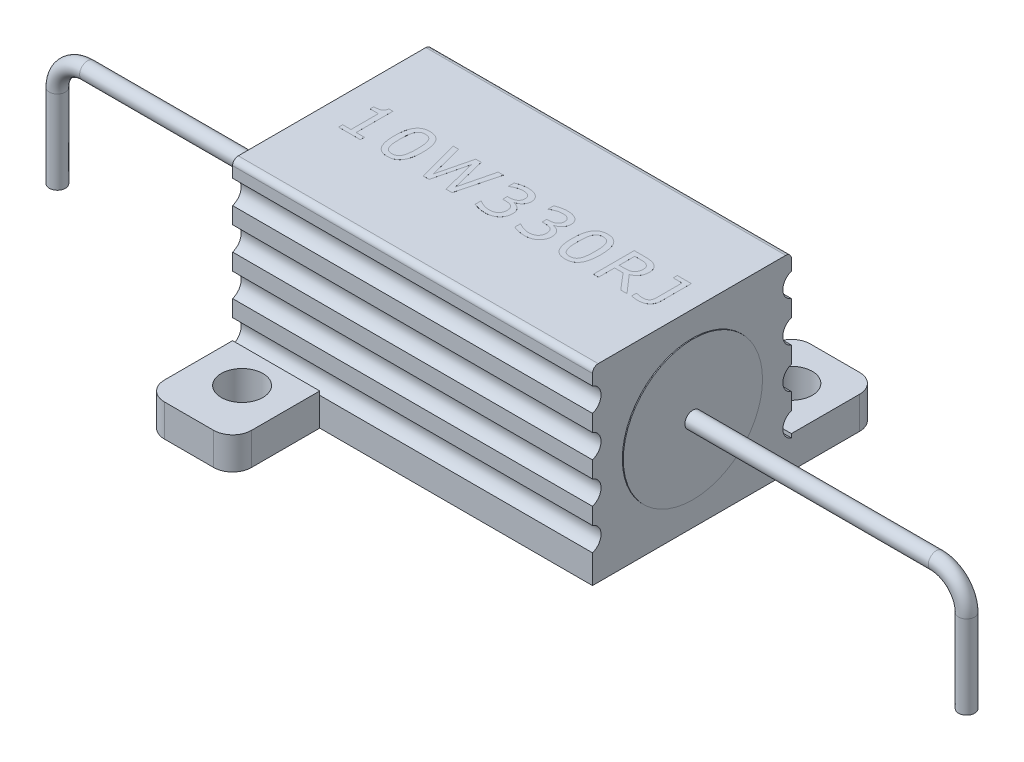
from build123d import *

# Parameters (mm, degrees)
BOSS_EXTRUDE1_DEPTH = 9.5
SKETCH2_R           = 1.1
BOSS_EXTRUDE2_DEPTH = 1.7
SKETCH3_R           = 3.675
BOSS_EXTRUDE3_DEPTH = 9.55
BOSS_EXTRUDE6_DEPTH = 0.001
SWEEP1_PROFILE_R    = 0.425


with BuildPart() as part:
    # Sketch1 → Boss-Extrude1 (new, symmetric)
    with BuildSketch(Plane(origin=(0, 0, 0), x_dir=(0, 0, -1), z_dir=(1, 0, 0))):
        with BuildLine():
            Line((-4.95, 5), (4.95, 5))
            ThreePointArc((4.95, 5), (5.162132034, 4.912132034), (5.25, 4.7))
            Line((5.25, 4.7), (5.25, 4.125))
            ThreePointArc((5.25, 4.125), (4.8, 3.5), (5.25, 2.875))
            Line((5.25, 2.875), (5.25, 2))
            ThreePointArc((5.25, 2), (4.8, 1.375), (5.25, 0.75))
            Line((5.25, 0.75), (5.25, -0.125))
            ThreePointArc((5.25, -0.125), (4.8, -0.75), (5.25, -1.375))
            Line((5.25, -1.375), (5.25, -2.25))
            ThreePointArc((5.25, -2.25), (4.8, -2.875), (5.25, -3.5))
            Line((5.25, -3.5), (5.25, -5))
            Line((5.25, -5), (-5.25, -5))
            Line((-5.25, -5), (-5.25, -3.5))
            ThreePointArc((-5.25, -3.5), (-4.8, -2.875), (-5.25, -2.25))
            Line((-5.25, -2.25), (-5.25, -1.375))
            ThreePointArc((-5.25, -1.375), (-4.8, -0.75), (-5.25, -0.125))
            Line((-5.25, -0.125), (-5.25, 0.75))
            ThreePointArc((-5.25, 0.75), (-4.8, 1.375), (-5.25, 2))
            Line((-5.25, 2), (-5.25, 2.875))
            ThreePointArc((-5.25, 2.875), (-4.8, 3.5), (-5.25, 4.125))
            Line((-5.25, 4.125), (-5.25, 4.7))
            ThreePointArc((-5.25, 4.7), (-5.162132034, 4.912132034), (-4.95, 5))
        make_face()
    extrude(amount=BOSS_EXTRUDE1_DEPTH, both=True)

    # Sketch2 → Boss-Extrude2 (add)
    # profile 1 of 2: a face of its own
    with BuildSketch(Plane.XZ.offset(5)):
        with BuildLine():
            Line((-4.9, 8.85), (-4.9, 5.25))
            Line((-4.9, 5.25), (-9.5, 5.25))
            Line((-9.5, 5.25), (-9.5, 8.85))
            ThreePointArc((-9.5, 8.85), (-9.207106781, 9.557106781), (-8.5, 9.85))
            Line((-8.5, 9.85), (-5.9, 9.85))
            ThreePointArc((-5.9, 9.85), (-5.192893219, 9.557106781), (-4.9, 8.85))
        make_face()
        with Locations(Location((-7.2, 7.05, 0), (0, 0, 90))):
            Circle(SKETCH2_R, mode=Mode.SUBTRACT)
    # profile 2 of 2: a face of its own
    with BuildSketch(Plane.XZ.offset(5)):
        with BuildLine():
            Line((4.9, -8.85), (4.9, -5.25))
            Line((4.9, -5.25), (9.5, -5.25))
            Line((9.5, -5.25), (9.5, -8.85))
            ThreePointArc((9.5, -8.85), (9.207106781, -9.557106781), (8.5, -9.85))
            Line((8.5, -9.85), (5.9, -9.85))
            ThreePointArc((5.9, -9.85), (5.192893219, -9.557106781), (4.9, -8.85))
        make_face()
        with Locations(Location((7.2, -7.55, 0), (0, 0, 90))):
            Circle(SKETCH2_R, mode=Mode.SUBTRACT)
    extrude(amount=-BOSS_EXTRUDE2_DEPTH)

    # Sketch3 → Boss-Extrude3 (add, symmetric)
    with BuildSketch(Plane(origin=(0, 0, 0), x_dir=(0, 0, -1), z_dir=(1, 0, 0))):
        with Locations(Location((0, 0, 0), (0, 0, 180))):
            Circle(SKETCH3_R)
    extrude(amount=BOSS_EXTRUDE3_DEPTH, both=True)

    # Sketch7 → Boss-Extrude6 (add)
    # profile 1 of 8: a face of its own
    with BuildSketch(Plane(origin=(0, 5, 0), x_dir=(1, 0, 0), z_dir=(0, 1, 0))):
        with BuildLine():
            add(Edge.make_bspline(
                [(8.301500939, -0.428209134), (8.301062759, -0.451139319), (8.300207962, -0.495871214), (8.29201733, -0.560917209), (8.278328298, -0.621921589), (8.259611151, -0.678890096), (8.235685509, -0.732088674), (8.205617016, -0.780816478), (8.170282201, -0.825541687), (8.130173555, -0.866207529), (8.085145884, -0.902021533), (8.036294909, -0.933177949), (7.983967978, -0.959998554), (7.927662195, -0.980985193), (7.868126832, -0.99839108), (7.804646886, -1.010168803), (7.737531753, -1.016882767), (7.691588805, -1.01795472), (7.66809833, -1.018502806)],
                knots=[0, 0, 0, 0, 1.120755748, 2.186355242, 3.198933757, 4.173448826, 5.113591064, 6.0441882, 6.96548279, 7.895169476, 8.830564272, 9.772249413, 10.724232925, 11.699641407, 12.705819706, 13.753628003, 14.85143754, 16, 16, 16, 16], degree=3))
            add(Edge.make_bspline(
                [(7.66809833, -1.018502806), (7.655576493, -1.018281429), (7.628669118, -1.017805726), (7.585391188, -1.015631182), (7.536466535, -1.011576798), (7.483500798, -1.006784825), (7.430017002, -1.000454105), (7.379492216, -0.993714401), (7.333455228, -0.98665922), (7.304569248, -0.980766212), (7.29078842, -0.977954795)],
                knots=[0, 0, 0, 0, 0.791051374, 1.699839779, 2.736493337, 3.89186054, 5.058981669, 6.138045988, 7.111705107, 8, 8, 8, 8], degree=3))
            Line((7.29078842, -0.977954795), (7.29078842, -0.718020706))
            Line((7.29078842, -0.718020706), (7.307007624, -0.718020706))
            add(Edge.make_bspline(
                [(7.307007624, -0.718020706), (7.317518242, -0.721073113), (7.339727339, -0.727522896), (7.374934936, -0.736281462), (7.413680531, -0.745198697), (7.469865845, -0.758120324), (7.544005961, -0.769903904), (7.604451824, -0.771734522), (7.634806279, -0.772653815)],
                knots=[0, 0, 0, 0, 0.590882725, 1.248544343, 1.958456919, 2.737484183, 4.36164324, 6, 6, 6, 6], degree=3))
            add(Edge.make_bspline(
                [(7.634806279, -0.772653815), (7.656166994, -0.772461792), (7.696565415, -0.77209863), (7.753750946, -0.765824302), (7.804166318, -0.756974089), (7.848135312, -0.743827985), (7.885713307, -0.726302863), (7.918530574, -0.706683731), (7.945823511, -0.682713598), (7.959908837, -0.664069505), (7.966873146, -0.654851173)],
                knots=[0, 0, 0, 0, 1.398250317, 2.64443893, 3.76295224, 4.747439987, 5.639718209, 6.472395588, 7.244695641, 8, 8, 8, 8], degree=3))
            add(Edge.make_bspline(
                [(7.966873146, -0.654851173), (7.973123074, -0.644754521), (7.985890653, -0.624128716), (8.00018326, -0.589718454), (8.010856248, -0.552166937), (8.01792722, -0.511357587), (8.022046048, -0.467230454), (8.026382554, -0.420034325), (8.027586578, -0.36945425), (8.028080428, -0.334734153), (8.028335394, -0.31680881)],
                knots=[0, 0, 0, 0, 0.816858895, 1.668708864, 2.555793622, 3.501563013, 4.516682111, 5.608029468, 6.765069871, 8, 8, 8, 8], degree=3))
            Line((8.028335394, -0.31680881), (8.028335394, 0.948289124))
            Line((8.028335394, 0.948289124), (7.563953966, 0.948289124))
            Line((7.563953966, 0.948289124), (7.563953966, 1.166821561))
            Line((7.563953966, 1.166821561), (8.301500939, 1.166821561))
            Line((8.301500939, 1.166821561), (8.301500939, -0.428209134))
        make_face()
    # profile 2 of 8: a face of its own
    with BuildSketch(Plane(origin=(0, 5, 0), x_dir=(1, 0, 0), z_dir=(0, 1, 0))):
        with BuildLine():
            Line((7.061329361, -0.991186252), (6.732677064, -0.991186252))
            Line((6.732677064, -0.991186252), (6.009642009, -0.144373059))
            Line((6.009642009, -0.144373059), (5.558918859, -0.144373059))
            Line((5.558918859, -0.144373059), (5.558918859, -0.991186252))
            Line((5.558918859, -0.991186252), (5.285753313, -0.991186252))
            Line((5.285753313, -0.991186252), (5.285753313, 1.166821561))
            Line((5.285753313, 1.166821561), (5.881168839, 1.166821561))
            add(Edge.make_bspline(
                [(5.881168839, 1.166821561), (5.911904641, 1.166472923), (5.970853538, 1.165804262), (6.055196595, 1.161362849), (6.131528924, 1.153188929), (6.200821451, 1.142460798), (6.264493868, 1.126868517), (6.324352246, 1.106865387), (6.38084595, 1.081349474), (6.416018135, 1.06031351), (6.433475427, 1.049872562)],
                knots=[0, 0, 0, 0, 1.288415781, 2.47108201, 3.538680541, 4.505415573, 5.408010686, 6.28309489, 7.147834801, 8, 8, 8, 8], degree=3))
            add(Edge.make_bspline(
                [(6.433475427, 1.049872562), (6.452026827, 1.037078239), (6.488585095, 1.011865139), (6.537119705, 0.96673622), (6.579672909, 0.917229328), (6.615529177, 0.862228728), (6.645093896, 0.801194489), (6.664320145, 0.732114873), (6.677231551, 0.655974161), (6.678326802, 0.602624186), (6.678897597, 0.574820604)],
                knots=[0, 0, 0, 0, 0.963681284, 1.899076006, 2.827943621, 3.752026167, 4.702860247, 5.71857009, 6.811022445, 8, 8, 8, 8], degree=3))
            add(Edge.make_bspline(
                [(6.678897597, 0.574820604), (6.678625354, 0.555598427), (6.678091765, 0.517923456), (6.672258237, 0.462607834), (6.663428322, 0.409685206), (6.651117052, 0.358950296), (6.6348117, 0.310761633), (6.615286137, 0.264774292), (6.591531855, 0.221526872), (6.564676259, 0.18058669), (6.534747071, 0.141998395), (6.501618388, 0.106199002), (6.466249688, 0.072220036), (6.427699426, 0.041172177), (6.386656883, 0.012446678), (6.342851411, -0.013476084), (6.29674251, -0.037756999), (6.264283621, -0.051287438), (6.24780822, -0.058155184)],
                knots=[0, 0, 0, 0, 1.126128489, 2.207182719, 3.255820935, 4.268986334, 5.263032379, 6.234153775, 7.193063852, 8.150486488, 9.10116855, 10.051301984, 11.006725633, 11.972966631, 12.949086479, 13.94005042, 14.954415947, 16, 16, 16, 16], degree=3))
            Line((6.24780822, -0.058155184), (7.061329361, -0.991186252))
        make_face()
        with BuildLine():
            add(Edge.make_bspline(
                [(6.378415496, 0.557747758), (6.377971198, 0.572844297), (6.377099984, 0.602446679), (6.371324006, 0.645451141), (6.360741748, 0.685692535), (6.3469982, 0.723523011), (6.327871321, 0.758604596), (6.303778717, 0.790961831), (6.274058419, 0.820260432), (6.251042386, 0.836627929), (6.239271797, 0.844998402)],
                knots=[0, 0, 0, 0, 1.085368415, 2.128268547, 3.1106313, 4.071895604, 5.014699805, 5.972038339, 6.962883605, 8, 8, 8, 8], degree=3))
            add(Edge.make_bspline(
                [(6.239271797, 0.844998402), (6.228604901, 0.85180502), (6.207086192, 0.865536253), (6.17141029, 0.881662578), (6.133145922, 0.894956933), (6.091691298, 0.904385193), (6.047293245, 0.912407267), (5.999182294, 0.916968655), (5.947387007, 0.920798106), (5.911624057, 0.92091308), (5.893119831, 0.92097257)],
                knots=[0, 0, 0, 0, 0.843459406, 1.701540853, 2.6053125, 3.542575708, 4.535326681, 5.614234208, 6.765573065, 8, 8, 8, 8], degree=3))
            Line((5.893119831, 0.92097257), (5.558918859, 0.92097257))
            Line((5.558918859, 0.92097257), (5.558918859, 0.101475932))
            Line((5.558918859, 0.101475932), (5.846169503, 0.101475932))
            add(Edge.make_bspline(
                [(5.846169503, 0.101475932), (5.867940616, 0.101875983), (5.910102619, 0.102650723), (5.971162163, 0.106530503), (6.027777382, 0.114646486), (6.080634985, 0.124057898), (6.129372962, 0.139365906), (6.174597803, 0.158655492), (6.215627535, 0.184205627), (6.239932801, 0.204747189), (6.252076431, 0.215010362)],
                knots=[0, 0, 0, 0, 1.210655428, 2.344558938, 3.398352313, 4.389640028, 5.325372474, 6.232137918, 7.116723723, 8, 8, 8, 8], degree=3))
            add(Edge.make_bspline(
                [(6.252076431, 0.215010362), (6.262457948, 0.225435283), (6.282891639, 0.245954405), (6.308447076, 0.280726063), (6.330481884, 0.317018657), (6.348305899, 0.35624545), (6.362124373, 0.399316777), (6.371832469, 0.447392266), (6.377073819, 0.500864381), (6.377955501, 0.538245239), (6.378415496, 0.557747758)],
                knots=[0, 0, 0, 0, 0.936271895, 1.842841591, 2.741489519, 3.638077323, 4.58130199, 5.617848582, 6.75717263, 8, 8, 8, 8], degree=3))
        make_face(mode=Mode.SUBTRACT)
    # profile 3 of 8: a face of its own
    with BuildSketch(Plane(origin=(0, 5, 0), x_dir=(1, 0, 0), z_dir=(0, 1, 0))):
        with BuildLine():
            add(Edge.make_bspline(
                [(4.591912826, 0.089098118), (4.591353613, 0.041848931), (4.590272953, -0.049458383), (4.581610809, -0.181638091), (4.567992152, -0.304102208), (4.548113125, -0.416947039), (4.522086392, -0.519875811), (4.491359082, -0.613537941), (4.454273883, -0.697330653), (4.411111584, -0.771557169), (4.361383045, -0.836281508), (4.306227081, -0.89291909), (4.243999476, -0.940318371), (4.175378527, -0.978887087), (4.100625831, -1.009523582), (4.01934013, -1.030460626), (3.932048472, -1.043592204), (3.871772552, -1.045061906), (3.840707575, -1.045819361)],
                knots=[0, 0, 0, 0, 1.462515791, 2.826257887, 4.098588437, 5.27524076, 6.370122553, 7.382635979, 8.323051561, 9.201518962, 10.033957328, 10.843681618, 11.641751814, 12.446417794, 13.274089048, 14.135116487, 15.038877147, 16, 16, 16, 16], degree=3))
            add(Edge.make_bspline(
                [(3.840707575, -1.045819361), (3.809212218, -1.045098232), (3.74805899, -1.043698047), (3.659634021, -1.030066088), (3.5776768, -1.008737016), (3.502453028, -0.977966512), (3.433460505, -0.939199462), (3.371546893, -0.890664903), (3.315852417, -0.833906211), (3.267463826, -0.767632726), (3.225245962, -0.692694118), (3.188330153, -0.608837037), (3.158064046, -0.515475498), (3.133099403, -0.412986518), (3.113023383, -0.301410168), (3.099241818, -0.18037659), (3.091304605, -0.050010601), (3.090116532, 0.040002392), (3.089502324, 0.086537191)],
                knots=[0, 0, 0, 0, 0.975561823, 1.894207913, 2.765987644, 3.594712337, 4.406414096, 5.210884434, 6.024787292, 6.863552976, 7.746360406, 8.68618482, 9.698595331, 10.784175386, 11.95364431, 13.210072149, 14.557666754, 16, 16, 16, 16], degree=3))
            add(Edge.make_bspline(
                [(3.089502324, 0.086537191), (3.090065458, 0.133359552), (3.091155063, 0.223956004), (3.099777381, 0.355000449), (3.113451301, 0.476611919), (3.133437337, 0.588673687), (3.158839964, 0.691437414), (3.189724778, 0.785011098), (3.226741865, 0.86901978), (3.26958212, 0.943767297), (3.318583977, 1.009428031), (3.37406986, 1.066527212), (3.436481632, 1.114483883), (3.504939473, 1.154241965), (3.57996298, 1.184704721), (3.661388042, 1.205601292), (3.748902543, 1.219364942), (3.809494326, 1.220744173), (3.840707575, 1.22145467)],
                knots=[0, 0, 0, 0, 1.450126419, 2.805845482, 4.065763501, 5.238744047, 6.328896909, 7.341983365, 8.2869572, 9.167511018, 10.004780552, 10.818108853, 11.62549425, 12.434993413, 13.263133086, 14.124647823, 15.033931127, 16, 16, 16, 16], degree=3))
            add(Edge.make_bspline(
                [(3.840707575, 1.22145467), (3.872198672, 1.220719142), (3.933343628, 1.219290997), (4.021863604, 1.205850454), (4.103830389, 1.183766123), (4.179386413, 1.15307733), (4.247893205, 1.112871696), (4.310048073, 1.06419704), (4.36557078, 1.006491624), (4.413826829, 0.939473181), (4.456306068, 0.863970861), (4.492829151, 0.779667173), (4.523323976, 0.686246914), (4.548896734, 0.584304748), (4.568214851, 0.473149532), (4.582207954, 0.353177198), (4.590091653, 0.224079336), (4.591292665, 0.135063048), (4.591912826, 0.089098118)],
                knots=[0, 0, 0, 0, 0.976576377, 1.896177831, 2.770013405, 3.605358433, 4.418491692, 5.226516336, 6.047603033, 6.894359061, 7.781924088, 8.73081062, 9.740083278, 10.827858728, 11.989075843, 13.238041405, 14.5738202, 16, 16, 16, 16], degree=3))
        make_face()
        with BuildLine():
            add(Edge.make_bspline(
                [(4.204786029, -0.571621046), (4.212790423, -0.551103816), (4.229194022, -0.509057354), (4.24826829, -0.441937656), (4.262958171, -0.369841197), (4.27394369, -0.292130347), (4.281927947, -0.207948723), (4.287228022, -0.116116364), (4.290682758, -0.016210645), (4.291175043, 0.053099756), (4.291430726, 0.089098118)],
                knots=[0, 0, 0, 0, 0.787920239, 1.614704221, 2.493559176, 3.419679904, 4.422442709, 5.519279532, 6.711566037, 8, 8, 8, 8], degree=3))
            add(Edge.make_bspline(
                [(4.291430726, 0.089098118), (4.291172523, 0.124811988), (4.290673481, 0.193837932), (4.287219407, 0.293599845), (4.281890217, 0.386144012), (4.273857773, 0.471584061), (4.263298559, 0.550551176), (4.247721713, 0.622773387), (4.229217685, 0.689254479), (4.211897155, 0.730051576), (4.203505566, 0.749817282)],
                knots=[0, 0, 0, 0, 1.277209098, 2.468524563, 3.569546968, 4.59175249, 5.537266852, 6.41645201, 7.232789931, 8, 8, 8, 8], degree=3))
            add(Edge.make_bspline(
                [(4.203505566, 0.749817282), (4.194664368, 0.767537488), (4.177466934, 0.8020059), (4.145564361, 0.848757326), (4.107644428, 0.887422179), (4.06599911, 0.920240868), (4.018280356, 0.945380836), (3.964698204, 0.963246088), (3.904729496, 0.973970072), (3.862664133, 0.975044741), (3.840707575, 0.975605679)],
                knots=[0, 0, 0, 0, 1.041868962, 2.026588758, 2.964039316, 3.882297917, 4.806977878, 5.787445238, 6.845128519, 8, 8, 8, 8], degree=3))
            add(Edge.make_bspline(
                [(3.840707575, 0.975605679), (3.819033587, 0.975044649), (3.777389248, 0.973966689), (3.717745127, 0.96312823), (3.663882424, 0.945317559), (3.615536568, 0.920184203), (3.572608741, 0.887757614), (3.535306203, 0.84744272), (3.501405477, 0.800916412), (3.48420456, 0.765493741), (3.475348658, 0.747256355)],
                knots=[0, 0, 0, 0, 1.130982529, 2.173066616, 3.152892545, 4.083472911, 5.006338149, 5.947185184, 6.943106974, 8, 8, 8, 8], degree=3))
            add(Edge.make_bspline(
                [(3.475348658, 0.747256355), (3.467417683, 0.728045244), (3.450731904, 0.687627465), (3.432547298, 0.620820724), (3.417779586, 0.546216536), (3.407024356, 0.464202415), (3.399782112, 0.376146599), (3.394240555, 0.283357597), (3.390776038, 0.186296991), (3.390252013, 0.120258923), (3.389984424, 0.086537191)],
                knots=[0, 0, 0, 0, 0.743461611, 1.564150376, 2.473168407, 3.465097376, 4.523434166, 5.635793492, 6.792739709, 8, 8, 8, 8], degree=3))
            add(Edge.make_bspline(
                [(3.389984424, 0.086537191), (3.390105774, 0.050255661), (3.390338051, -0.019191166), (3.393245481, -0.118821509), (3.398462643, -0.209177721), (3.404798114, -0.291280735), (3.415040476, -0.366733574), (3.429500009, -0.437366153), (3.448282498, -0.504222076), (3.465294976, -0.546288192), (3.473641373, -0.566926013)],
                knots=[0, 0, 0, 0, 1.312806302, 2.512855192, 3.605999759, 4.587601144, 5.491851682, 6.359134938, 7.194984378, 8, 8, 8, 8], degree=3))
            add(Edge.make_bspline(
                [(3.473641373, -0.566926013), (3.481983691, -0.58496742), (3.498169428, -0.619971292), (3.529868167, -0.66709745), (3.5663186, -0.707718596), (3.608293817, -0.741739158), (3.656700257, -0.768158492), (3.711785998, -0.786953231), (3.773975439, -0.797923201), (3.817755499, -0.799266259), (3.840707575, -0.799970369)],
                knots=[0, 0, 0, 0, 1.023553745, 1.985895355, 2.915557442, 3.828632731, 4.757744765, 5.743701395, 6.817115868, 8, 8, 8, 8], degree=3))
            add(Edge.make_bspline(
                [(3.840707575, -0.799970369), (3.862378446, -0.799395458), (3.904156905, -0.798287107), (3.963978402, -0.787577787), (4.018038662, -0.769562447), (4.066669606, -0.744690867), (4.109618091, -0.712079271), (4.146985289, -0.672038938), (4.180027505, -0.625282326), (4.196374099, -0.589852946), (4.204786029, -0.571621046)],
                knots=[0, 0, 0, 0, 1.131665358, 2.181695236, 3.162112733, 4.099850787, 5.023273204, 5.964688273, 6.952632, 8, 8, 8, 8], degree=3))
        make_face(mode=Mode.SUBTRACT)
    # profile 4 of 8: a face of its own
    with BuildSketch(Plane(origin=(0, 5, 0), x_dir=(1, 0, 0), z_dir=(0, 1, 0))):
        with BuildLine():
            add(Edge.make_bspline(
                [(2.318407206, 0.038306399), (2.329741877, 0.027434295), (2.352615246, 0.005494383), (2.382892552, -0.031934161), (2.409892637, -0.07333568), (2.434112542, -0.118776204), (2.454238928, -0.169975043), (2.467949121, -0.227843913), (2.475894509, -0.292543562), (2.47702037, -0.337841448), (2.477611501, -0.361625033)],
                knots=[0, 0, 0, 0, 0.847484043, 1.710223126, 2.592412854, 3.513457184, 4.486482436, 5.554204071, 6.715838676, 8, 8, 8, 8], degree=3))
            add(Edge.make_bspline(
                [(2.477611501, -0.361625033), (2.476937271, -0.385842565), (2.475614812, -0.433343646), (2.465716048, -0.503231019), (2.448546894, -0.569828116), (2.425105262, -0.633219159), (2.395381115, -0.692643501), (2.36075859, -0.748659023), (2.320114662, -0.800530108), (2.289134304, -0.831706064), (2.273590984, -0.847347519)],
                knots=[0, 0, 0, 0, 1.072189339, 2.103028086, 3.117625413, 4.112331199, 5.08999265, 6.054966346, 7.024146796, 8, 8, 8, 8], degree=3))
            add(Edge.make_bspline(
                [(2.273590984, -0.847347519), (2.255007504, -0.863568109), (2.217858512, -0.895993608), (2.155782418, -0.937102328), (2.08888788, -0.97110119), (2.017773094, -0.999149828), (1.94220383, -1.019586564), (1.863234345, -1.035151263), (1.780536157, -1.044138454), (1.724293334, -1.045252498), (1.695675126, -1.045819361)],
                knots=[0, 0, 0, 0, 0.94513944, 1.889365109, 2.845868606, 3.818496383, 4.815247057, 5.843513068, 6.902708155, 8, 8, 8, 8], degree=3))
            add(Edge.make_bspline(
                [(1.695675126, -1.045819361), (1.665777311, -1.045376896), (1.606296979, -1.044496634), (1.517391805, -1.035848328), (1.429287983, -1.022876996), (1.34319404, -1.004498486), (1.261569014, -0.982961931), (1.186434494, -0.959915109), (1.118750997, -0.936407467), (1.076982145, -0.918562746), (1.057150663, -0.91009023)],
                knots=[0, 0, 0, 0, 1.091633847, 2.17175542, 3.259350248, 4.342654255, 5.384955613, 6.341552815, 7.212583926, 8, 8, 8, 8], degree=3))
            Line((1.057150663, -0.91009023), (1.057150663, -0.608754487))
            Line((1.057150663, -0.608754487), (1.078918542, -0.608754487))
            add(Edge.make_bspline(
                [(1.078918542, -0.608754487), (1.100088183, -0.622133339), (1.143267128, -0.649421694), (1.212675866, -0.685678955), (1.287680816, -0.718009289), (1.366775349, -0.746516831), (1.447828738, -0.770727221), (1.528884681, -0.786917953), (1.608441044, -0.798006767), (1.661066301, -0.799319831), (1.687138703, -0.799970369)],
                knots=[0, 0, 0, 0, 0.930231768, 1.897359876, 2.905960645, 3.962824014, 5.020110383, 6.045473768, 7.03165901, 8, 8, 8, 8], degree=3))
            add(Edge.make_bspline(
                [(1.687138703, -0.799970369), (1.702524549, -0.799696379), (1.733979242, -0.799136234), (1.78157488, -0.792637156), (1.830638332, -0.783271261), (1.880073441, -0.770325679), (1.928205586, -0.753863565), (1.972288722, -0.732742977), (2.0121121, -0.708795986), (2.034953095, -0.689177175), (2.046095303, -0.679606801)],
                knots=[0, 0, 0, 0, 0.955105117, 1.9526087, 2.978673282, 4.056885304, 5.124578998, 6.132597257, 7.089050672, 8, 8, 8, 8], degree=3))
            add(Edge.make_bspline(
                [(2.046095303, -0.679606801), (2.056750154, -0.668888517), (2.077648257, -0.647866001), (2.103936315, -0.612773119), (2.126923709, -0.576886681), (2.145739319, -0.538637893), (2.160002434, -0.496623092), (2.170042133, -0.450097137), (2.175929865, -0.39848164), (2.17671784, -0.362494632), (2.177129401, -0.343698544)],
                knots=[0, 0, 0, 0, 0.974089691, 1.910549984, 2.822386268, 3.721564009, 4.653513387, 5.678162238, 6.787299389, 8, 8, 8, 8], degree=3))
            add(Edge.make_bspline(
                [(2.177129401, -0.343698544), (2.176837024, -0.325173071), (2.176274492, -0.289530157), (2.168779715, -0.238788019), (2.157566489, -0.192802842), (2.141053424, -0.151945396), (2.121029727, -0.115242734), (2.096900645, -0.083056232), (2.069413945, -0.054766153), (2.048461572, -0.039383412), (2.037985701, -0.031692272)],
                knots=[0, 0, 0, 0, 1.246176778, 2.397637793, 3.445421562, 4.425515979, 5.35590216, 6.252488577, 7.126270542, 8, 8, 8, 8], degree=3))
            add(Edge.make_bspline(
                [(2.037985701, -0.031692272), (2.026625641, -0.024425635), (2.003665938, -0.009739109), (1.965364578, 0.007238614), (1.923883914, 0.020882292), (1.863013011, 0.034365989), (1.781077875, 0.044359602), (1.714058006, 0.045997291), (1.679455922, 0.046842823)],
                knots=[0, 0, 0, 0, 0.651204319, 1.316142418, 2.018760635, 2.759665618, 4.327028642, 6, 6, 6, 6], degree=3))
            Line((1.679455922, 0.046842823), (1.548848645, 0.046842823))
            Line((1.548848645, 0.046842823), (1.548848645, 0.292691814))
            Line((1.548848645, 0.292691814), (1.648297977, 0.292691814))
            add(Edge.make_bspline(
                [(1.648297977, 0.292691814), (1.66595428, 0.292837097), (1.70033873, 0.293120025), (1.750328651, 0.298212538), (1.797777688, 0.305110136), (1.842351107, 0.315946423), (1.884410525, 0.329008417), (1.923681373, 0.345234282), (1.959875418, 0.365105176), (1.993793279, 0.387046385), (2.024115449, 0.412163424), (2.050561429, 0.440226785), (2.072762961, 0.471171042), (2.09142969, 0.504706991), (2.105474388, 0.541228751), (2.115143592, 0.580391041), (2.121288164, 0.622147447), (2.122085541, 0.650914719), (2.122496292, 0.665733513)],
                knots=[0, 0, 0, 0, 1.240419804, 2.415633327, 3.528743283, 4.608144501, 5.636053556, 6.622252983, 7.58878585, 8.534609379, 9.457798559, 10.349242878, 11.237427791, 12.12814259, 13.039995841, 13.978654942, 14.958750962, 16, 16, 16, 16], degree=3))
            add(Edge.make_bspline(
                [(2.122496292, 0.665733513), (2.122069319, 0.678842931), (2.121243136, 0.70420941), (2.115332252, 0.741167284), (2.104520956, 0.775378833), (2.089925419, 0.807152569), (2.07187676, 0.836408978), (2.050480596, 0.863045796), (2.025502928, 0.886716611), (2.006849387, 0.90012316), (1.99743769, 0.906887471)],
                knots=[0, 0, 0, 0, 1.109336041, 2.146544552, 3.155699887, 4.136221373, 5.098536494, 6.057531715, 7.019922155, 8, 8, 8, 8], degree=3))
            add(Edge.make_bspline(
                [(1.99743769, 0.906887471), (1.987160948, 0.913064867), (1.96667433, 0.925379465), (1.934007817, 0.940233071), (1.900299567, 0.952219099), (1.852637139, 0.964403863), (1.787779443, 0.97351487), (1.734405411, 0.974885246), (1.706345655, 0.975605679)],
                knots=[0, 0, 0, 0, 0.711216309, 1.417805135, 2.125604048, 2.832243336, 4.334649322, 6, 6, 6, 6], degree=3))
            add(Edge.make_bspline(
                [(1.706345655, 0.975605679), (1.683269074, 0.97502669), (1.636079402, 0.973842705), (1.564393765, 0.964024989), (1.49062437, 0.947871921), (1.415311646, 0.926536541), (1.340240749, 0.898557706), (1.266225965, 0.866444488), (1.194663135, 0.828324551), (1.149151502, 0.799077554), (1.126295691, 0.784389797)],
                knots=[0, 0, 0, 0, 0.894418222, 1.829010174, 2.799457441, 3.820802859, 4.860878205, 5.903159842, 6.946972907, 8, 8, 8, 8], degree=3))
            Line((1.126295691, 0.784389797), (1.111783772, 0.784389797))
            Line((1.111783772, 0.784389797), (1.111783772, 1.085725539))
            add(Edge.make_bspline(
                [(1.111783772, 1.085725539), (1.130179631, 1.094212209), (1.169266543, 1.112244404), (1.233638672, 1.135887408), (1.306581323, 1.158120227), (1.386207009, 1.179576025), (1.469516631, 1.198425731), (1.553390751, 1.211306909), (1.635876039, 1.220082451), (1.690388892, 1.220999533), (1.717443006, 1.22145467)],
                knots=[0, 0, 0, 0, 0.777624147, 1.652270079, 2.630230247, 3.704883216, 4.818215269, 5.907609184, 6.961570091, 8, 8, 8, 8], degree=3))
            add(Edge.make_bspline(
                [(1.717443006, 1.22145467), (1.742920014, 1.221176123), (1.792373902, 1.22063543), (1.864221425, 1.215065661), (1.93133547, 1.20567354), (1.994334565, 1.193027788), (2.053465045, 1.175950294), (2.109442777, 1.154422096), (2.162489496, 1.12869606), (2.195385284, 1.10767591), (2.211701915, 1.097249711)],
                knots=[0, 0, 0, 0, 1.181529625, 2.293488736, 3.339666156, 4.323260697, 5.271417361, 6.190562388, 7.102501307, 8, 8, 8, 8], degree=3))
            add(Edge.make_bspline(
                [(2.211701915, 1.097249711), (2.228409351, 1.085295121), (2.261094397, 1.06190815), (2.303557239, 1.020135481), (2.340278428, 0.975244826), (2.370248872, 0.926210439), (2.394141735, 0.87337885), (2.411203981, 0.816439676), (2.421026834, 0.755136982), (2.422315741, 0.71300408), (2.422978392, 0.691342783)],
                knots=[0, 0, 0, 0, 1.030246025, 2.015488056, 2.980657051, 3.93641939, 4.892528807, 5.884791777, 6.912532717, 8, 8, 8, 8], degree=3))
            add(Edge.make_bspline(
                [(2.422978392, 0.691342783), (2.422501414, 0.676248291), (2.421562259, 0.646527681), (2.416114119, 0.60258299), (2.406079219, 0.560391802), (2.392863646, 0.519273126), (2.375444895, 0.479777148), (2.353774872, 0.441891408), (2.328475629, 0.40548683), (2.299680813, 0.37088041), (2.26821743, 0.338550217), (2.234898687, 0.309298653), (2.200729998, 0.282446054), (2.164740251, 0.259249653), (2.127007601, 0.239951347), (2.088508679, 0.22244103), (2.048332455, 0.208725709), (2.020691673, 0.202393869), (2.006827756, 0.199217979)],
                knots=[0, 0, 0, 0, 1.040593361, 2.04889782, 3.04554796, 4.02546284, 5.02211298, 6.014605761, 7.029232238, 8.073837562, 9.114015009, 10.135206882, 11.127699663, 12.1069274, 13.080640536, 14.04642105, 15.020134186, 16, 16, 16, 16], degree=3))
            Line((2.006827756, 0.199217979), (2.006827756, 0.178730563))
            add(Edge.make_bspline(
                [(2.006827756, 0.178730563), (2.018818421, 0.176485879), (2.044012575, 0.171769466), (2.082543871, 0.160803738), (2.123754457, 0.147128187), (2.166362659, 0.130340707), (2.20887412, 0.111196557), (2.248920893, 0.089557838), (2.285740231, 0.065721423), (2.307624758, 0.047355327), (2.318407206, 0.038306399)],
                knots=[0, 0, 0, 0, 0.847072829, 1.779824847, 2.779997163, 3.862895895, 4.959821874, 6.016836294, 7.022900478, 8, 8, 8, 8], degree=3))
        make_face()
    # profile 5 of 8: a face of its own
    with BuildSketch(Plane(origin=(0, 5, 0), x_dir=(1, 0, 0), z_dir=(0, 1, 0))):
        with BuildLine():
            add(Edge.make_bspline(
                [(0.231422436, 0.038306399), (0.242757106, 0.027434295), (0.265630475, 0.005494383), (0.295907781, -0.031934161), (0.322907867, -0.07333568), (0.347127771, -0.118776204), (0.367254158, -0.169975043), (0.38096435, -0.227843913), (0.388909738, -0.292543562), (0.390035599, -0.337841448), (0.390626731, -0.361625033)],
                knots=[0, 0, 0, 0, 0.847484043, 1.710223126, 2.592412854, 3.513457184, 4.486482436, 5.554204071, 6.715838676, 8, 8, 8, 8], degree=3))
            add(Edge.make_bspline(
                [(0.390626731, -0.361625033), (0.3899525, -0.385842565), (0.388630041, -0.433343646), (0.378731277, -0.503231019), (0.361562124, -0.569828116), (0.338120491, -0.633219159), (0.308396345, -0.692643501), (0.273773819, -0.748659023), (0.233129891, -0.800530108), (0.202149534, -0.831706064), (0.186606214, -0.847347519)],
                knots=[0, 0, 0, 0, 1.072189339, 2.103028086, 3.117625413, 4.112331199, 5.08999265, 6.054966346, 7.024146796, 8, 8, 8, 8], degree=3))
            add(Edge.make_bspline(
                [(0.186606214, -0.847347519), (0.168022734, -0.863568109), (0.130873741, -0.895993608), (0.068797647, -0.937102328), (0.001903109, -0.97110119), (-0.069211676, -0.999149828), (-0.144780941, -1.019586564), (-0.223750426, -1.035151263), (-0.306448614, -1.044138454), (-0.362691437, -1.045252498), (-0.391309644, -1.045819361)],
                knots=[0, 0, 0, 0, 0.94513944, 1.889365109, 2.845868606, 3.818496383, 4.815247057, 5.843513068, 6.902708155, 8, 8, 8, 8], degree=3))
            add(Edge.make_bspline(
                [(-0.391309644, -1.045819361), (-0.42120746, -1.045376896), (-0.480687791, -1.044496634), (-0.569592966, -1.035848328), (-0.657696788, -1.022876996), (-0.743790731, -1.004498486), (-0.825415756, -0.982961931), (-0.900550276, -0.959915109), (-0.968233773, -0.936407467), (-1.010002626, -0.918562746), (-1.029834108, -0.91009023)],
                knots=[0, 0, 0, 0, 1.091633847, 2.17175542, 3.259350248, 4.342654255, 5.384955613, 6.341552815, 7.212583926, 8, 8, 8, 8], degree=3))
            Line((-1.029834108, -0.91009023), (-1.029834108, -0.608754487))
            Line((-1.029834108, -0.608754487), (-1.008066229, -0.608754487))
            add(Edge.make_bspline(
                [(-1.008066229, -0.608754487), (-0.986896588, -0.622133339), (-0.943717642, -0.649421694), (-0.874308904, -0.685678955), (-0.799303955, -0.718009289), (-0.720209422, -0.746516831), (-0.639156032, -0.770727221), (-0.55810009, -0.786917953), (-0.478543726, -0.798006767), (-0.425918469, -0.799319831), (-0.399846068, -0.799970369)],
                knots=[0, 0, 0, 0, 0.930231768, 1.897359876, 2.905960645, 3.962824014, 5.020110383, 6.045473768, 7.03165901, 8, 8, 8, 8], degree=3))
            add(Edge.make_bspline(
                [(-0.399846068, -0.799970369), (-0.384460221, -0.799696379), (-0.353005529, -0.799136234), (-0.305409891, -0.792637156), (-0.256346439, -0.783271261), (-0.20691133, -0.770325679), (-0.158779185, -0.753863565), (-0.114696048, -0.732742977), (-0.074872671, -0.708795986), (-0.052031675, -0.689177175), (-0.040889468, -0.679606801)],
                knots=[0, 0, 0, 0, 0.955105117, 1.9526087, 2.978673282, 4.056885304, 5.124578998, 6.132597257, 7.089050672, 8, 8, 8, 8], degree=3))
            add(Edge.make_bspline(
                [(-0.040889468, -0.679606801), (-0.030234616, -0.668888517), (-0.009336514, -0.647866001), (0.016951544, -0.612773119), (0.039938938, -0.576886681), (0.058754548, -0.538637893), (0.073017664, -0.496623092), (0.083057362, -0.450097137), (0.088945095, -0.39848164), (0.089733069, -0.362494632), (0.09014463, -0.343698544)],
                knots=[0, 0, 0, 0, 0.974089691, 1.910549984, 2.822386268, 3.721564009, 4.653513387, 5.678162238, 6.787299389, 8, 8, 8, 8], degree=3))
            add(Edge.make_bspline(
                [(0.09014463, -0.343698544), (0.089852253, -0.325173071), (0.089289722, -0.289530157), (0.081794945, -0.238788019), (0.070581719, -0.192802842), (0.054068653, -0.151945396), (0.034044956, -0.115242734), (0.009915874, -0.083056232), (-0.017570826, -0.054766153), (-0.038523198, -0.039383412), (-0.04899907, -0.031692272)],
                knots=[0, 0, 0, 0, 1.246176778, 2.397637793, 3.445421562, 4.425515979, 5.35590216, 6.252488577, 7.126270542, 8, 8, 8, 8], degree=3))
            add(Edge.make_bspline(
                [(-0.04899907, -0.031692272), (-0.06035913, -0.024425635), (-0.083318832, -0.009739109), (-0.121620192, 0.007238614), (-0.163100856, 0.020882292), (-0.223971759, 0.034365989), (-0.305906896, 0.044359602), (-0.372926765, 0.045997291), (-0.407528849, 0.046842823)],
                knots=[0, 0, 0, 0, 0.651204319, 1.316142418, 2.018760635, 2.759665618, 4.327028642, 6, 6, 6, 6], degree=3))
            Line((-0.407528849, 0.046842823), (-0.538136125, 0.046842823))
            Line((-0.538136125, 0.046842823), (-0.538136125, 0.292691814))
            Line((-0.538136125, 0.292691814), (-0.438686794, 0.292691814))
            add(Edge.make_bspline(
                [(-0.438686794, 0.292691814), (-0.421030491, 0.292837097), (-0.38664604, 0.293120025), (-0.336656119, 0.298212538), (-0.289207083, 0.305110136), (-0.244633664, 0.315946423), (-0.202574245, 0.329008417), (-0.163303397, 0.345234282), (-0.127109353, 0.365105176), (-0.093191492, 0.387046385), (-0.062869321, 0.412163424), (-0.036423341, 0.440226785), (-0.01422181, 0.471171042), (0.004444919, 0.504706991), (0.018489618, 0.541228751), (0.028158822, 0.580391041), (0.034303393, 0.622147447), (0.035100771, 0.650914719), (0.035511521, 0.665733513)],
                knots=[0, 0, 0, 0, 1.240419804, 2.415633327, 3.528743283, 4.608144501, 5.636053556, 6.622252983, 7.58878585, 8.534609379, 9.457798559, 10.349242878, 11.237427791, 12.12814259, 13.039995841, 13.978654942, 14.958750962, 16, 16, 16, 16], degree=3))
            add(Edge.make_bspline(
                [(0.035511521, 0.665733513), (0.035084549, 0.678842931), (0.034258365, 0.70420941), (0.028347481, 0.741167284), (0.017536185, 0.775378833), (0.002940649, 0.807152569), (-0.015108011, 0.836408978), (-0.036504175, 0.863045796), (-0.061481843, 0.886716611), (-0.080135384, 0.90012316), (-0.089547081, 0.906887471)],
                knots=[0, 0, 0, 0, 1.109336041, 2.146544552, 3.155699887, 4.136221373, 5.098536494, 6.057531715, 7.019922155, 8, 8, 8, 8], degree=3))
            add(Edge.make_bspline(
                [(-0.089547081, 0.906887471), (-0.099823822, 0.913064867), (-0.120310441, 0.925379465), (-0.152976953, 0.940233071), (-0.186685203, 0.952219099), (-0.234347632, 0.964403863), (-0.299205328, 0.97351487), (-0.352579359, 0.974885246), (-0.380639115, 0.975605679)],
                knots=[0, 0, 0, 0, 0.711216309, 1.417805135, 2.125604048, 2.832243336, 4.334649322, 6, 6, 6, 6], degree=3))
            add(Edge.make_bspline(
                [(-0.380639115, 0.975605679), (-0.403715697, 0.97502669), (-0.450905369, 0.973842705), (-0.522591006, 0.964024989), (-0.596360401, 0.947871921), (-0.671673124, 0.926536541), (-0.746744022, 0.898557706), (-0.820758805, 0.866444488), (-0.892321636, 0.828324551), (-0.937833268, 0.799077554), (-0.960689079, 0.784389797)],
                knots=[0, 0, 0, 0, 0.894418222, 1.829010174, 2.799457441, 3.820802859, 4.860878205, 5.903159842, 6.946972907, 8, 8, 8, 8], degree=3))
            Line((-0.960689079, 0.784389797), (-0.975200999, 0.784389797))
            Line((-0.975200999, 0.784389797), (-0.975200999, 1.085725539))
            add(Edge.make_bspline(
                [(-0.975200999, 1.085725539), (-0.95680514, 1.094212209), (-0.917718227, 1.112244404), (-0.853346098, 1.135887408), (-0.780403447, 1.158120227), (-0.700777761, 1.179576025), (-0.617468139, 1.198425731), (-0.533594019, 1.211306909), (-0.451108732, 1.220082451), (-0.396595878, 1.220999533), (-0.369541765, 1.22145467)],
                knots=[0, 0, 0, 0, 0.777624147, 1.652270079, 2.630230247, 3.704883216, 4.818215269, 5.907609184, 6.961570091, 8, 8, 8, 8], degree=3))
            add(Edge.make_bspline(
                [(-0.369541765, 1.22145467), (-0.344064756, 1.221176123), (-0.294610869, 1.22063543), (-0.222763345, 1.215065661), (-0.155649301, 1.20567354), (-0.092650205, 1.193027788), (-0.033519726, 1.175950294), (0.022458006, 1.154422096), (0.075504725, 1.12869606), (0.108400513, 1.10767591), (0.124717145, 1.097249711)],
                knots=[0, 0, 0, 0, 1.181529625, 2.293488736, 3.339666156, 4.323260697, 5.271417361, 6.190562388, 7.102501307, 8, 8, 8, 8], degree=3))
            add(Edge.make_bspline(
                [(0.124717145, 1.097249711), (0.141424581, 1.085295121), (0.174109626, 1.06190815), (0.216572469, 1.020135481), (0.253293658, 0.975244826), (0.283264102, 0.926210439), (0.307156964, 0.87337885), (0.324219211, 0.816439676), (0.334042064, 0.755136982), (0.335330971, 0.71300408), (0.335993621, 0.691342783)],
                knots=[0, 0, 0, 0, 1.030246025, 2.015488056, 2.980657051, 3.93641939, 4.892528807, 5.884791777, 6.912532717, 8, 8, 8, 8], degree=3))
            add(Edge.make_bspline(
                [(0.335993621, 0.691342783), (0.335516644, 0.676248291), (0.334577488, 0.646527681), (0.329129348, 0.60258299), (0.319094448, 0.560391802), (0.305878876, 0.519273126), (0.288460124, 0.479777148), (0.266790102, 0.441891408), (0.241490858, 0.40548683), (0.212696042, 0.37088041), (0.18123266, 0.338550217), (0.147913917, 0.309298653), (0.113745227, 0.282446054), (0.077755481, 0.259249653), (0.040022831, 0.239951347), (0.001523909, 0.22244103), (-0.038652316, 0.208725709), (-0.066293098, 0.202393869), (-0.080157015, 0.199217979)],
                knots=[0, 0, 0, 0, 1.040593361, 2.04889782, 3.04554796, 4.02546284, 5.02211298, 6.014605761, 7.029232238, 8.073837562, 9.114015009, 10.135206882, 11.127699663, 12.1069274, 13.080640536, 14.04642105, 15.020134186, 16, 16, 16, 16], degree=3))
            Line((-0.080157015, 0.199217979), (-0.080157015, 0.178730563))
            add(Edge.make_bspline(
                [(-0.080157015, 0.178730563), (-0.06816635, 0.176485879), (-0.042972196, 0.171769466), (-0.0044409, 0.160803738), (0.036769686, 0.147128187), (0.079377888, 0.130340707), (0.12188935, 0.111196557), (0.161936123, 0.089557838), (0.198755461, 0.065721423), (0.220639987, 0.047355327), (0.231422436, 0.038306399)],
                knots=[0, 0, 0, 0, 0.847072829, 1.779824847, 2.779997163, 3.862895895, 4.959821874, 6.016836294, 7.022900478, 8, 8, 8, 8], degree=3))
        make_face()
    # profile 6 of 8: a face of its own
    with BuildSketch(Plane(origin=(0, 5, 0), x_dir=(1, 0, 0), z_dir=(0, 1, 0))):
        Polygon((-1.614408376, 1.166821561), (-2.171409997, -0.991186252), (-2.492379514, -0.991186252), (-2.942675843, 0.80018218), (-3.383155286, -0.991186252), (-3.696868842, -0.991186252), (-4.264114171, 1.166821561), (-3.981985381, 1.166821561), (-3.521445343, -0.627534619), (-3.077978153, 1.166821561), (-2.789020223, 1.166821561), (-2.341284821, -0.644607465), (-1.896537167, 1.166821561), align=None)
    # profile 7 of 8: a face of its own
    with BuildSketch(Plane(origin=(0, 5, 0), x_dir=(1, 0, 0), z_dir=(0, 1, 0))):
        with BuildLine():
            add(Edge.make_bspline(
                [(-4.79405533, 0.089098118), (-4.794614544, 0.041848931), (-4.795695204, -0.049458383), (-4.804357348, -0.181638091), (-4.817976004, -0.304102208), (-4.837855031, -0.416947039), (-4.863881765, -0.519875811), (-4.894609075, -0.613537941), (-4.931694274, -0.697330653), (-4.974856573, -0.771557169), (-5.024585112, -0.836281508), (-5.079741076, -0.89291909), (-5.141968681, -0.940318371), (-5.21058963, -0.978887087), (-5.285342325, -1.009523582), (-5.366628027, -1.030460626), (-5.453919685, -1.043592204), (-5.514195604, -1.045061906), (-5.545260581, -1.045819361)],
                knots=[0, 0, 0, 0, 1.462515791, 2.826257887, 4.098588437, 5.27524076, 6.370122553, 7.382635979, 8.323051561, 9.201518962, 10.033957328, 10.843681618, 11.641751814, 12.446417794, 13.274089048, 14.135116487, 15.038877147, 16, 16, 16, 16], degree=3))
            add(Edge.make_bspline(
                [(-5.545260581, -1.045819361), (-5.576755939, -1.045098232), (-5.637909167, -1.043698047), (-5.726334136, -1.030066088), (-5.808291357, -1.008737016), (-5.883515129, -0.977966512), (-5.952507652, -0.939199462), (-6.014421263, -0.890664903), (-6.07011574, -0.833906211), (-6.11850433, -0.767632726), (-6.160722195, -0.692694118), (-6.197638003, -0.608837037), (-6.227904111, -0.515475498), (-6.252868753, -0.412986518), (-6.272944774, -0.301410168), (-6.286726339, -0.18037659), (-6.294663552, -0.050010601), (-6.295851624, 0.040002392), (-6.296465833, 0.086537191)],
                knots=[0, 0, 0, 0, 0.975561823, 1.894207913, 2.765987644, 3.594712337, 4.406414096, 5.210884434, 6.024787292, 6.863552976, 7.746360406, 8.68618482, 9.698595331, 10.784175386, 11.95364431, 13.210072149, 14.557666754, 16, 16, 16, 16], degree=3))
            add(Edge.make_bspline(
                [(-6.296465833, 0.086537191), (-6.295902699, 0.133359552), (-6.294813093, 0.223956004), (-6.286190776, 0.355000449), (-6.272516855, 0.476611919), (-6.25253082, 0.588673687), (-6.227128192, 0.691437414), (-6.196243378, 0.785011098), (-6.159226291, 0.86901978), (-6.116386036, 0.943767297), (-6.06738418, 1.009428031), (-6.011898296, 1.066527212), (-5.949486525, 1.114483883), (-5.881028684, 1.154241965), (-5.806005176, 1.184704721), (-5.724580114, 1.205601292), (-5.637065614, 1.219364942), (-5.576473831, 1.220744173), (-5.545260581, 1.22145467)],
                knots=[0, 0, 0, 0, 1.450126419, 2.805845482, 4.065763501, 5.238744047, 6.328896909, 7.341983365, 8.2869572, 9.167511018, 10.004780552, 10.818108853, 11.62549425, 12.434993413, 13.263133086, 14.124647823, 15.033931127, 16, 16, 16, 16], degree=3))
            add(Edge.make_bspline(
                [(-5.545260581, 1.22145467), (-5.513769485, 1.220719142), (-5.452624529, 1.219290997), (-5.364104552, 1.205850454), (-5.282137768, 1.183766123), (-5.206581743, 1.15307733), (-5.138074952, 1.112871696), (-5.075920084, 1.06419704), (-5.020397376, 1.006491624), (-4.972141327, 0.939473181), (-4.929662088, 0.863970861), (-4.893139005, 0.779667173), (-4.862644181, 0.686246914), (-4.837071423, 0.584304748), (-4.817753306, 0.473149532), (-4.803760202, 0.353177198), (-4.795876503, 0.224079336), (-4.794675491, 0.135063048), (-4.79405533, 0.089098118)],
                knots=[0, 0, 0, 0, 0.976576377, 1.896177831, 2.770013405, 3.605358433, 4.418491692, 5.226516336, 6.047603033, 6.894359061, 7.781924088, 8.73081062, 9.740083278, 10.827858728, 11.989075843, 13.238041405, 14.5738202, 16, 16, 16, 16], degree=3))
        make_face()
        with BuildLine():
            add(Edge.make_bspline(
                [(-5.181182127, -0.571621046), (-5.173177734, -0.551103816), (-5.156774135, -0.509057354), (-5.137699867, -0.441937656), (-5.123009986, -0.369841197), (-5.112024467, -0.292130347), (-5.104040209, -0.207948723), (-5.098740135, -0.116116364), (-5.095285399, -0.016210645), (-5.094793113, 0.053099756), (-5.094537431, 0.089098118)],
                knots=[0, 0, 0, 0, 0.787920239, 1.614704221, 2.493559176, 3.419679904, 4.422442709, 5.519279532, 6.711566037, 8, 8, 8, 8], degree=3))
            add(Edge.make_bspline(
                [(-5.094537431, 0.089098118), (-5.094795634, 0.124811988), (-5.095294676, 0.193837932), (-5.098748749, 0.293599845), (-5.10407794, 0.386144012), (-5.112110384, 0.471584061), (-5.122669597, 0.550551176), (-5.138246444, 0.622773387), (-5.156750472, 0.689254479), (-5.174071001, 0.730051576), (-5.182462591, 0.749817282)],
                knots=[0, 0, 0, 0, 1.277209098, 2.468524563, 3.569546968, 4.59175249, 5.537266852, 6.41645201, 7.232789931, 8, 8, 8, 8], degree=3))
            add(Edge.make_bspline(
                [(-5.182462591, 0.749817282), (-5.191303789, 0.767537488), (-5.208501223, 0.8020059), (-5.240403796, 0.848757326), (-5.278323728, 0.887422179), (-5.319969047, 0.920240868), (-5.3676878, 0.945380836), (-5.421269953, 0.963246088), (-5.481238661, 0.973970072), (-5.523304023, 0.975044741), (-5.545260581, 0.975605679)],
                knots=[0, 0, 0, 0, 1.041868962, 2.026588758, 2.964039316, 3.882297917, 4.806977878, 5.787445238, 6.845128519, 8, 8, 8, 8], degree=3))
            add(Edge.make_bspline(
                [(-5.545260581, 0.975605679), (-5.56693457, 0.975044649), (-5.608578909, 0.973966689), (-5.668223029, 0.96312823), (-5.722085733, 0.945317559), (-5.770431589, 0.920184203), (-5.813359416, 0.887757614), (-5.850661953, 0.84744272), (-5.88456268, 0.800916412), (-5.901763596, 0.765493741), (-5.910619499, 0.747256355)],
                knots=[0, 0, 0, 0, 1.130982529, 2.173066616, 3.152892545, 4.083472911, 5.006338149, 5.947185184, 6.943106974, 8, 8, 8, 8], degree=3))
            add(Edge.make_bspline(
                [(-5.910619499, 0.747256355), (-5.918550473, 0.728045244), (-5.935236253, 0.687627465), (-5.953420858, 0.620820724), (-5.968188571, 0.546216536), (-5.978943801, 0.464202415), (-5.986186045, 0.376146599), (-5.991727602, 0.283357597), (-5.995192119, 0.186296991), (-5.995716144, 0.120258923), (-5.995983732, 0.086537191)],
                knots=[0, 0, 0, 0, 0.743461611, 1.564150376, 2.473168407, 3.465097376, 4.523434166, 5.635793492, 6.792739709, 8, 8, 8, 8], degree=3))
            add(Edge.make_bspline(
                [(-5.995983732, 0.086537191), (-5.995862382, 0.050255661), (-5.995630105, -0.019191166), (-5.992722676, -0.118821509), (-5.987505513, -0.209177721), (-5.981170042, -0.291280735), (-5.97092768, -0.366733574), (-5.956468148, -0.437366153), (-5.937685658, -0.504222076), (-5.92067318, -0.546288192), (-5.912326784, -0.566926013)],
                knots=[0, 0, 0, 0, 1.312806302, 2.512855192, 3.605999759, 4.587601144, 5.491851682, 6.359134938, 7.194984378, 8, 8, 8, 8], degree=3))
            add(Edge.make_bspline(
                [(-5.912326784, -0.566926013), (-5.903984465, -0.58496742), (-5.887798728, -0.619971292), (-5.856099989, -0.66709745), (-5.819649556, -0.707718596), (-5.77767434, -0.741739158), (-5.729267899, -0.768158492), (-5.674182158, -0.786953231), (-5.611992717, -0.797923201), (-5.568212658, -0.799266259), (-5.545260581, -0.799970369)],
                knots=[0, 0, 0, 0, 1.023553745, 1.985895355, 2.915557442, 3.828632731, 4.757744765, 5.743701395, 6.817115868, 8, 8, 8, 8], degree=3))
            add(Edge.make_bspline(
                [(-5.545260581, -0.799970369), (-5.523589711, -0.799395458), (-5.481811251, -0.798287107), (-5.421989755, -0.787577787), (-5.367929494, -0.769562447), (-5.31929855, -0.744690867), (-5.276350066, -0.712079271), (-5.238982868, -0.672038938), (-5.205940651, -0.625282326), (-5.189594057, -0.589852946), (-5.181182127, -0.571621046)],
                knots=[0, 0, 0, 0, 1.131665358, 2.181695236, 3.162112733, 4.099850787, 5.023273204, 5.964688273, 6.952632, 8, 8, 8, 8], degree=3))
        make_face(mode=Mode.SUBTRACT)
    # profile 8 of 8: a face of its own
    with BuildSketch(Plane(origin=(0, 5, 0), x_dir=(1, 0, 0), z_dir=(0, 1, 0))):
        with BuildLine():
            Line((-7.017622874, -0.991186252), (-8.164918167, -0.991186252))
            Line((-8.164918167, -0.991186252), (-8.164918167, -0.772653815))
            Line((-8.164918167, -0.772653815), (-7.727853293, -0.772653815))
            Line((-7.727853293, -0.772653815), (-7.727853293, 0.675123578))
            Line((-7.727853293, 0.675123578), (-8.164918167, 0.675123578))
            Line((-8.164918167, 0.675123578), (-8.164918167, 0.86633946))
            add(Edge.make_bspline(
                [(-8.164918167, 0.86633946), (-8.134160644, 0.86718415), (-8.070472034, 0.86893322), (-7.991022705, 0.878156798), (-7.928566717, 0.888877686), (-7.886931865, 0.899135468), (-7.851113292, 0.910599688), (-7.830195231, 0.920886684), (-7.820473486, 0.925667602)],
                knots=[0, 0, 0, 0, 1.572264815, 3.255638069, 4.083064771, 4.809788455, 5.446844848, 6, 6, 6, 6], degree=3))
            add(Edge.make_bspline(
                [(-7.820473486, 0.925667602), (-7.810070759, 0.931829841), (-7.789641521, 0.943931459), (-7.762301309, 0.965815105), (-7.738527172, 0.990142448), (-7.717451289, 1.016769604), (-7.7005959, 1.047764748), (-7.687881741, 1.08331408), (-7.678882946, 1.123460845), (-7.676562324, 1.151977031), (-7.67535429, 1.166821561)],
                knots=[0, 0, 0, 0, 0.980350179, 1.925245871, 2.831540329, 3.736878119, 4.67220159, 5.680374825, 6.79248419, 8, 8, 8, 8], degree=3))
            Line((-7.67535429, 1.166821561), (-7.454687747, 1.166821561))
            Line((-7.454687747, 1.166821561), (-7.454687747, -0.772653815))
            Line((-7.454687747, -0.772653815), (-7.017622874, -0.772653815))
            Line((-7.017622874, -0.772653815), (-7.017622874, -0.991186252))
        make_face()
    extrude(amount=BOSS_EXTRUDE6_DEPTH)

    # Sweep1: sweep along a path in Sketch9
    with BuildLine(Plane.XY) as sweep1_path:
        Line((24, -6), (24, -1.6))
        ThreePointArc((24, -1.6), (23.53137085, -0.46862915), (22.4, 0))
        Line((22.4, 0), (-22.4, 0))
        ThreePointArc((-22.4, 0), (-23.53137085, -0.46862915), (-24, -1.6))
        Line((-24, -1.6), (-24, -6))
    # Sweep1 profile (on start of the path) → Sweep1 (sweep)
    with BuildSketch(Plane(origin=(24, -6, 0), x_dir=(0, 0, 1), z_dir=(0, 1, 0))):
        Circle(SWEEP1_PROFILE_R)
    sweep(path=sweep1_path.line)


solid = part.part
